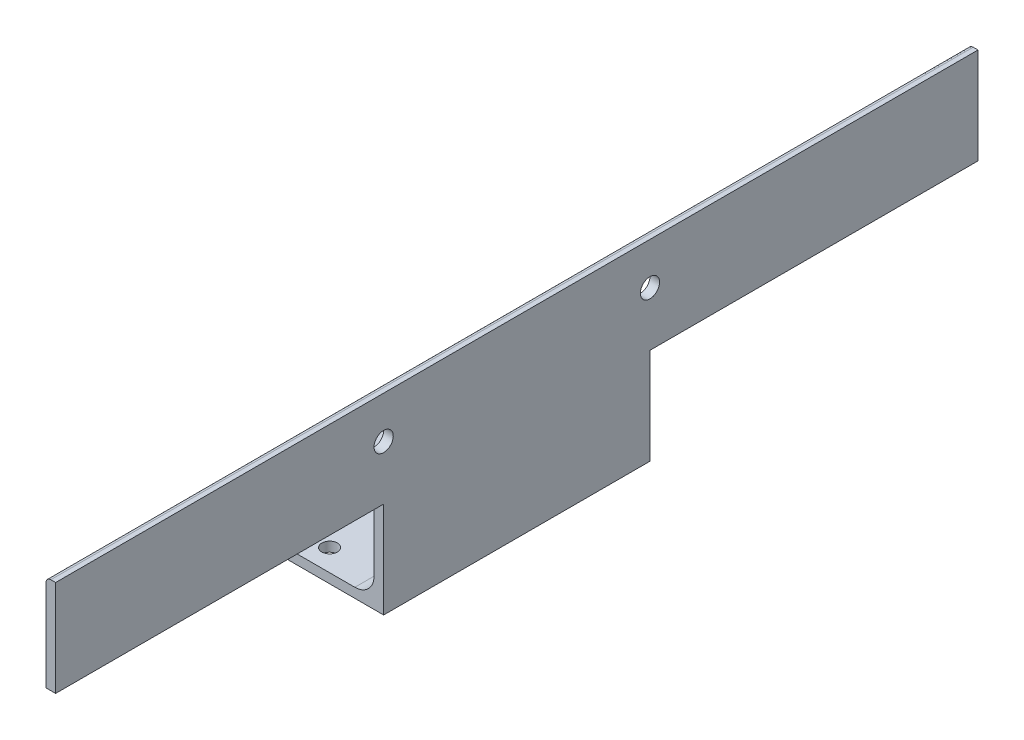
from build123d import *

# Parameters (mm, degrees)
BOSS_EXTRUDE1_DEPTH = 152.4
SKETCH3_R           = 2.585
CUT_EXTRUDE1_DEPTH  = 167.951873679
CUT_EXTRUDE2_DEPTH  = 169.125169145
SKETCH5_R           = 3.175
CUT_EXTRUDE3_DEPTH  = 169.125169145


with BuildPart() as part:
    # Sketch2 → Boss-Extrude1 (new, symmetric)
    with BuildSketch(Plane.XY):
        with BuildLine():
            Line((-31.75, -31.75), (31.75, -31.75))
            Line((31.75, -31.75), (31.75, 31.75))
            Line((31.75, 31.75), (30.1625, 31.75))
            ThreePointArc((30.1625, 31.75), (29.039967985, 31.285032015), (28.575, 30.1625))
            Line((28.575, 30.1625), (28.575, -22.225))
            ThreePointArc((28.575, -22.225), (26.715128061, -26.715128061), (22.225, -28.575))
            Line((22.225, -28.575), (-30.1625, -28.575))
            ThreePointArc((-30.1625, -28.575), (-31.285032015, -29.039967985), (-31.75, -30.1625))
            Line((-31.75, -30.1625), (-31.75, -31.75))
        make_face()
    extrude(amount=BOSS_EXTRUDE1_DEPTH, both=True)

    # Sketch3 → Cut-Extrude1 (cut, through all)
    with BuildSketch(Plane(origin=(0, -28.575, 0), x_dir=(1, 0, 0), z_dir=(0, 1, 0))):
        with Locations(Location((-14.321922022, 8.79, 0), (0, 0, 180))):
            Circle(SKETCH3_R)
        with Locations(Location((6.678077978, 8.79, 0), (0, 0, 180))):
            Circle(SKETCH3_R)
        with Locations(Location((-14.321922022, 36.79, 0), (0, 0, 180))):
            Circle(SKETCH3_R)
        with Locations(Location((6.678077978, 36.79, 0), (0, 0, 180))):
            Circle(SKETCH3_R)
        with Locations(Location((-14.321922022, -36.79, 0), (0, 0, 180))):
            Circle(SKETCH3_R)
        with Locations(Location((6.678077978, -36.79, 0), (0, 0, 180))):
            Circle(SKETCH3_R)
        with Locations(Location((6.678077978, -8.79, 0), (0, 0, 180))):
            Circle(SKETCH3_R)
        with Locations(Location((-14.321922022, -8.79, 0), (0, 0, 180))):
            Circle(SKETCH3_R)
    extrude(amount=-CUT_EXTRUDE1_DEPTH, mode=Mode.SUBTRACT)

    # Sketch4 → Cut-Extrude2 (cut, through all)
    with BuildSketch(Plane(origin=(31.75, 0, 0), x_dir=(0, 0, -1), z_dir=(1, 0, 0))):
        Polygon((-152.4, 0), (-44, 0), (-44, -48.044655534), (-168.625421563, -48.044655534), (-168.625421563, 0), align=None)
        Polygon((168.625421563, -48.044655534), (168.625421563, 0), (152.4, 0), (44, 0), (44, -48.044655534), align=None)
    extrude(amount=-CUT_EXTRUDE2_DEPTH, mode=Mode.SUBTRACT)

    # Sketch5 → Cut-Extrude3 (cut, through all)
    with BuildSketch(Plane(origin=(31.75, 0, 0), x_dir=(0, 0, -1), z_dir=(1, 0, 0))):
        with Locations(Location((-44, 17.904243602, 0), (0, 0, 90))):
            Circle(SKETCH5_R)
        with Locations(Location((44, 17.904243602, 0), (0, 0, 90))):
            Circle(SKETCH5_R)
    extrude(amount=-CUT_EXTRUDE3_DEPTH, mode=Mode.SUBTRACT)


solid = part.part
